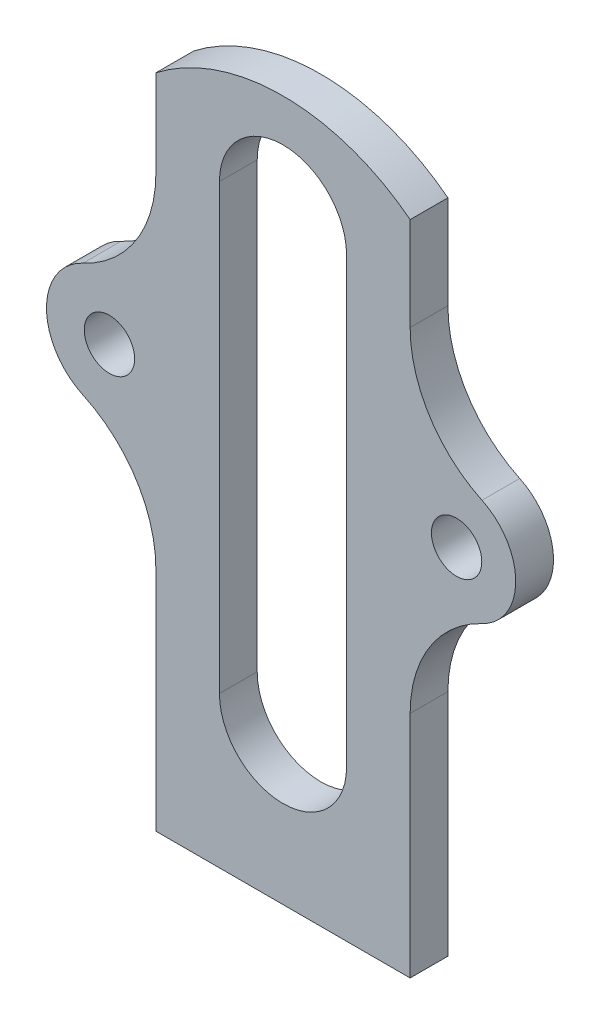
from build123d import *

# Parameters (mm, degrees)
SKETCH1_R           = 2
BOSS_EXTRUDE1_DEPTH = 3


with BuildPart() as part:
    # Sketch1 → Boss-Extrude1 (new body)
    with BuildSketch(Plane.XY.offset(26)):
        with BuildLine():
            Line((0, 0), (20.2, 0))
            Line((20.2, 0), (20.2, 18.206774978))
            ThreePointArc((20.2, 18.206774978), (21.746211994, 23.548447782), (25.906693669, 27.238248874))
            ThreePointArc((25.906693669, 27.238248874), (28.587297404, 31.480600764), (25.906693669, 35.722952653))
            ThreePointArc((25.906693669, 35.722952653), (21.746211994, 39.412753746), (20.2, 44.754426549))
            Line((20.2, 44.754426549), (20.2, 52.179630025))
            ThreePointArc((20.2, 52.179630025), (10.1, 55.643160629), (0, 52.179630025))
            Line((0, 52.179630025), (0, 45.258439456))
            ThreePointArc((0, 45.258439456), (-1.571872489, 39.876370461), (-5.793333333, 36.186286704))
            ThreePointArc((-5.793333333, 36.186286704), (-8.69, 31.650210328), (-5.793333333, 27.114133952))
            ThreePointArc((-5.793333333, 27.114133952), (-1.571872489, 23.424050195), (0, 18.0419812))
            Line((0, 18.0419812), (0, 0))
        make_face()
        with Locations((-3.69, 31.650210328)):
            Circle(SKETCH1_R, mode=Mode.SUBTRACT)
        with Locations((23.89, 31.480600764)):
            Circle(SKETCH1_R, mode=Mode.SUBTRACT)
        with BuildLine():
            Line((15.15, 12), (15.15, 47.222342094))
            ThreePointArc((15.15, 47.222342094), (10.1, 52.272342094), (5.05, 47.222342094))
            Line((5.05, 47.222342094), (5.05, 12))
            ThreePointArc((5.05, 12), (10.1, 6.95), (15.15, 12))
        make_face(mode=Mode.SUBTRACT)
    extrude(amount=-BOSS_EXTRUDE1_DEPTH)


solid = part.part
